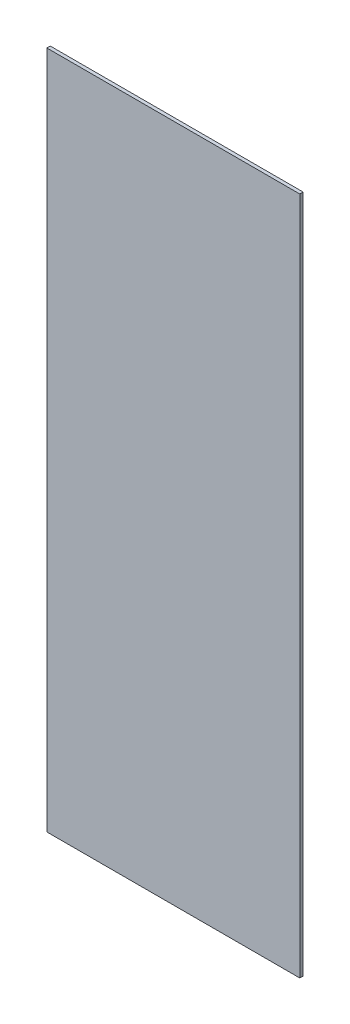
from build123d import *

# Parameters (mm, degrees)
SKETCH2_W           = 149
SKETCH2_H           = 400
BOSS_EXTRUDE1_DEPTH = 2


with BuildPart() as part:
    # Sketch2 → Boss-Extrude1 (new body)
    with BuildSketch(Plane.XY):
        Rectangle(SKETCH2_W, SKETCH2_H)
    extrude(amount=BOSS_EXTRUDE1_DEPTH)


solid = part.part
